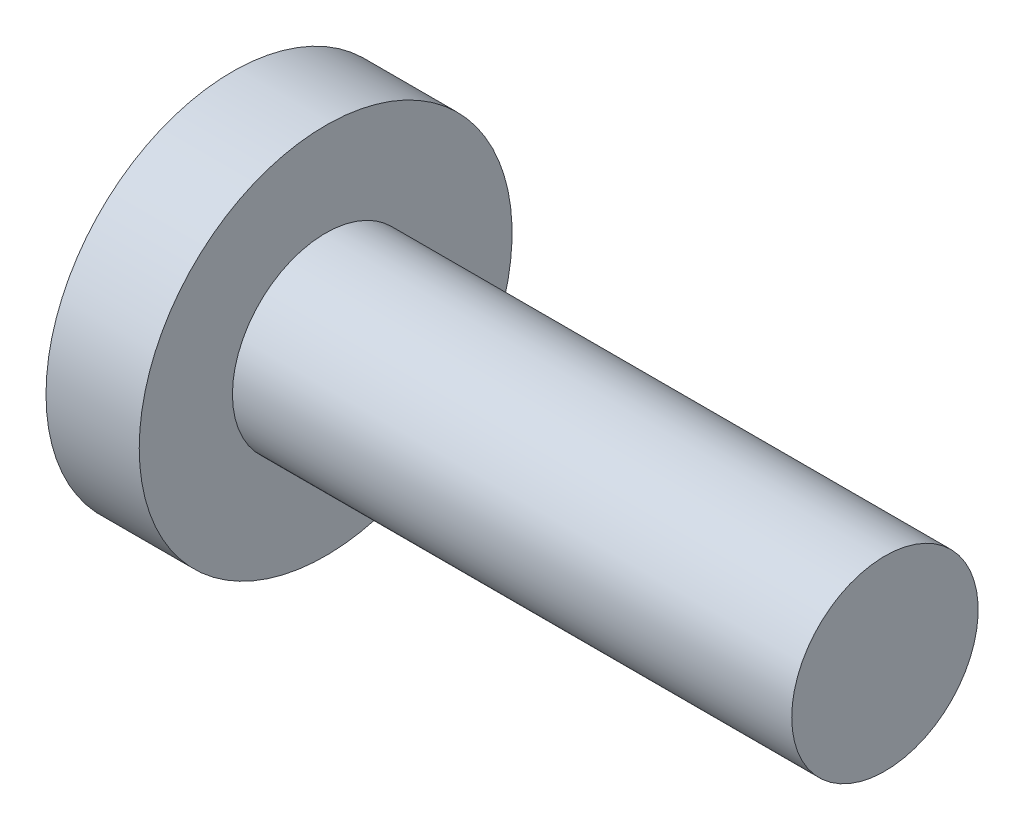
from build123d import *


with BuildPart() as part:
    # Esboço1 → Revolução1 (revolve)
    with BuildSketch(Plane.XY, mode=Mode.PRIVATE) as revolu_o1_sk:
        Polygon((0, 0), (0, 10), (5, 10), (5, 5), (35, 5), (35, 0), align=None)
    revolve(revolu_o1_sk.sketch.rotate(Axis((0, 0, 0), (1, 0, 0)), 90), axis=Axis((0, 0, 0), (1, 0, 0)))


solid = part.part
